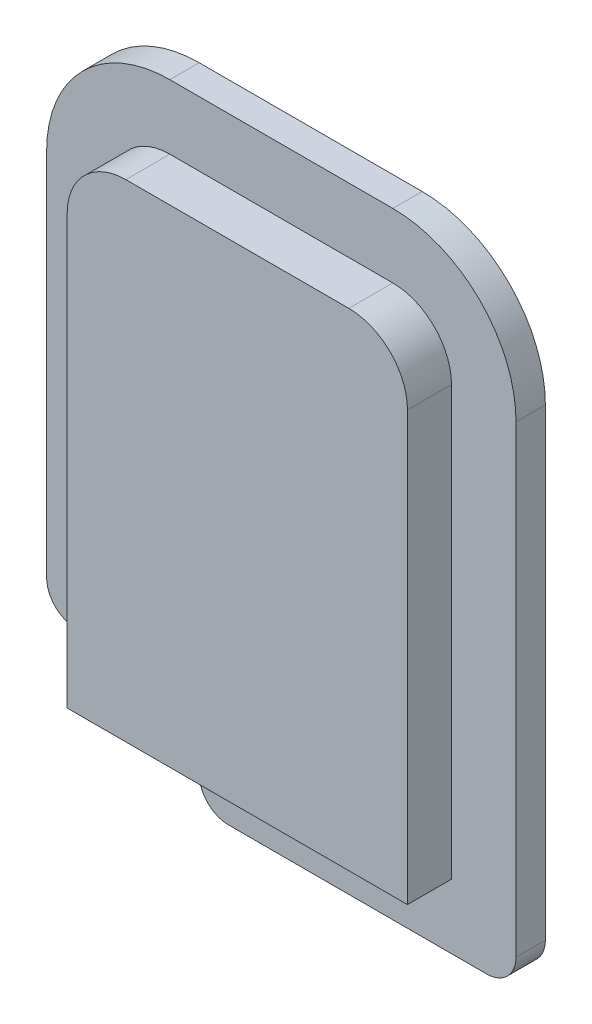
from build123d import *

# Parameters (mm, degrees)
SKETCH1_W           = 11.6
SKETCH1_H           = 16.6
BOSS_EXTRUDE1_DEPTH = 0.3
FILLET1_R           = 2
BOSS_EXTRUDE2_DEPTH = 1.2
BOSS_EXTRUDE3_DEPTH = 1
FILLET2_R           = 1


with BuildPart() as part:
    # Sketch1 → Boss-Extrude1 (new body)
    with BuildSketch(Plane.XY):
        Rectangle(SKETCH1_W, SKETCH1_H)
    extrude(amount=BOSS_EXTRUDE1_DEPTH)

    # Fillet1
    fillet1_edges = [part.edges().sort_by_distance(p)[0] for p in [
        (-5.8, 8.3, 0.15),
        (5.8, 8.3, 0.15),
    ]]
    fillet(fillet1_edges, radius=FILLET1_R)

    # Sketch2 → Boss-Extrude2 (add)
    with BuildSketch(Plane(origin=(0, 0, 0), x_dir=(-1, 0, 0), z_dir=(0, 0, -1))):
        with BuildLine():
            Line((-5.8, -8.3), (-5.8, 6.3))
            ThreePointArc((-5.8, 6.3), (-5.214213562, 7.714213562), (-3.8, 8.3))
            Line((-3.8, 8.3), (3.8, 8.3))
            ThreePointArc((3.8, 8.3), (5.214213562, 7.714213562), (5.8, 6.3))
            Line((5.8, 6.3), (5.8, -8.3))
            Line((5.8, -8.3), (-5.8, -8.3))
        make_face()
        with BuildLine():
            Line((-5, -7.5), (-5, 6.3))
            ThreePointArc((-5, 6.3), (-4.648528137, 7.148528137), (-3.8, 7.5))
            Line((-3.8, 7.5), (3.8, 7.5))
            ThreePointArc((3.8, 7.5), (4.648528137, 7.148528137), (5, 6.3))
            Line((5, 6.3), (5, -7.5))
            Line((5, -7.5), (-5, -7.5))
        make_face(mode=Mode.SUBTRACT)
    extrude(amount=BOSS_EXTRUDE2_DEPTH)

    # Sketch3 → Boss-Extrude3 (add)
    with BuildSketch(Plane(origin=(0, 0, -1.2), x_dir=(-1, 0, 0), z_dir=(0, 0, -1))):
        with BuildLine():
            Line((-8, 6.3), (-8, -10.5))
            Line((-8, -10.5), (2.8, -10.5))
            Line((2.8, -10.5), (2.8, -8.3))
            Line((2.8, -8.3), (5.8, -8.3))
            Line((5.8, -8.3), (5.8, -7.3))
            Line((5.8, -7.3), (8, -7.3))
            Line((8, -7.3), (8, 6.3))
            ThreePointArc((8, 6.3), (6.769848481, 9.269848481), (3.8, 10.5))
            Line((3.8, 10.5), (-3.8, 10.5))
            ThreePointArc((-3.8, 10.5), (-6.769848481, 9.269848481), (-8, 6.3))
        make_face()
        with BuildLine():
            Line((-5, 6.3), (-5, -7.5))
            Line((-5, -7.5), (5, -7.5))
            Line((5, -7.5), (5, 6.3))
            ThreePointArc((5, 6.3), (4.648528137, 7.148528137), (3.8, 7.5))
            Line((3.8, 7.5), (-3.8, 7.5))
            ThreePointArc((-3.8, 7.5), (-4.648528137, 7.148528137), (-5, 6.3))
        make_face(mode=Mode.SUBTRACT)
    extrude(amount=BOSS_EXTRUDE3_DEPTH)

    # Fillet2
    fillet2_edges = [part.edges().sort_by_distance(p)[0] for p in [
        (8, -10.5, -1.7),
        (-2.8, -10.5, -1.7),
        (-8, -7.3, -1.7),
    ]]
    fillet(fillet2_edges, radius=FILLET2_R)


solid = part.part
